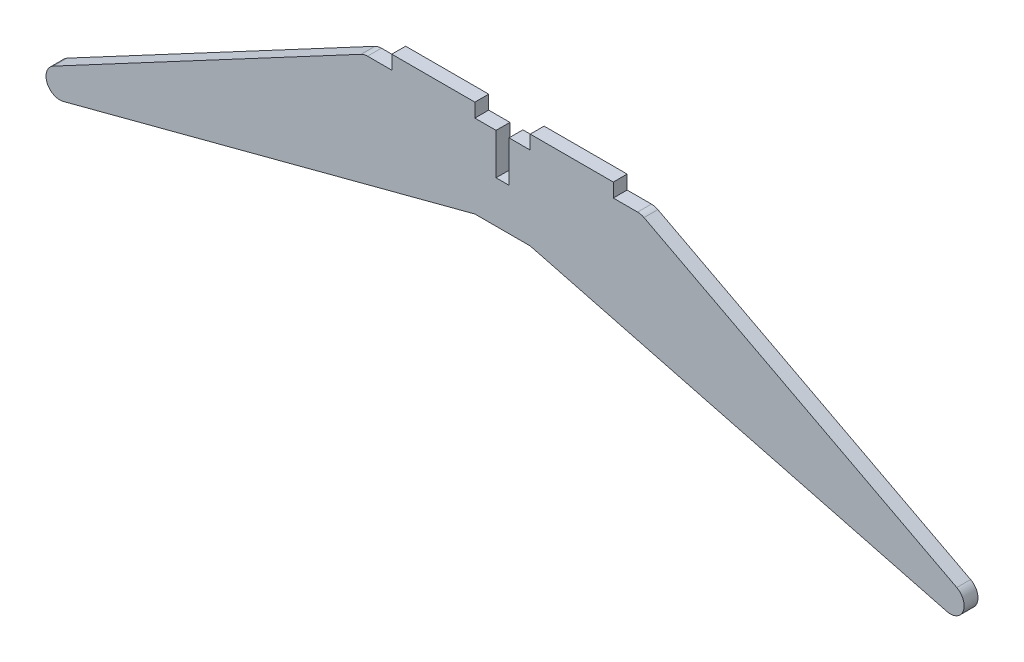
from build123d import *

# Parameters (mm, degrees)
BOSS_EXTRUDE1_DEPTH = 3.175


with BuildPart() as part:
    # Sketch1 → Boss-Extrude1 (new body)
    with BuildSketch(Plane.XY):
        with BuildLine():
            Line((25.4, 0), (30.968022768, 0))
            ThreePointArc((30.968022768, 0), (31.727309935, -0.092126666), (32.442533736, -0.363160318))
            Line((32.442533736, -0.363160318), (104.164919452, -37.973926384))
            ThreePointArc((104.164919452, -37.973926384), (105.652252875, -41.929489282), (101.892440564, -43.858854448))
            Line((101.892440564, -43.858854448), (6.35, -19.05))
            Line((6.35, -19.05), (-6.35, -19.05))
            Line((-6.35, -19.05), (-100.721752752, -43.884671777))
            ThreePointArc((-100.721752752, -43.884671777), (-104.48570891, -41.973107935), (-103.023886624, -38.012739532))
            Line((-103.023886624, -38.012739532), (-32.450367647, -0.373529412))
            ThreePointArc((-32.450367647, -0.373529412), (-31.726300609, -0.094797562), (-30.95625, 0))
            Line((-30.95625, 0), (-25.4, 0))
            Line((-25.4, 0), (-25.4, 3.175))
            Line((-25.4, 3.175), (-6.35, 3.175))
            Line((-6.35, 3.175), (-6.35, 0))
            Line((-6.35, 0), (-1.4859, 0))
            Line((-1.4859, 0), (-1.4859, -9.4234))
            Line((-1.4859, -9.4234), (1.4859, -9.4234))
            Line((1.4859, -9.4234), (1.4859, 0))
            Line((1.4859, 0), (6.35, 0))
            Line((6.35, 0), (6.35, 3.175))
            Line((6.35, 3.175), (25.4, 3.175))
            Line((25.4, 3.175), (25.4, 0))
        make_face()
    extrude(amount=BOSS_EXTRUDE1_DEPTH)


solid = part.part
